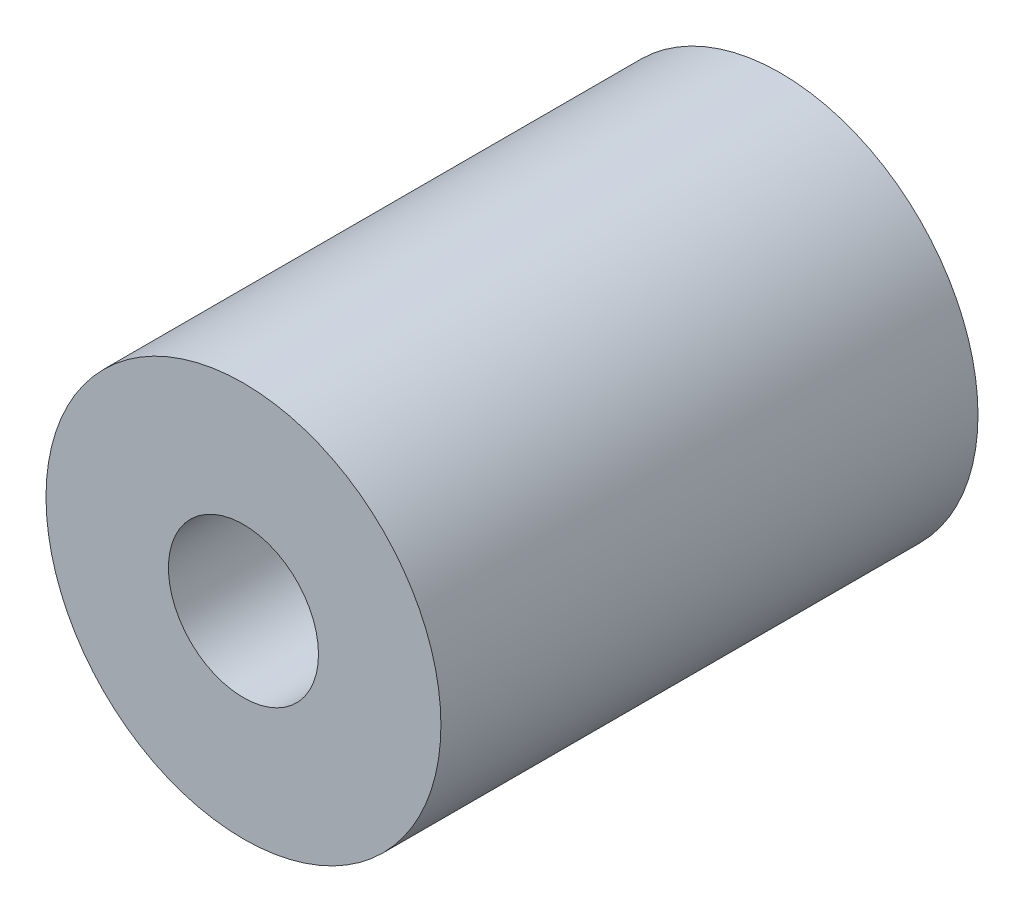
from build123d import *


with BuildPart() as part:
    # Sketch1 → REV_Bellows_Coupling_D50x68_bores_12_19 (revolve)
    with BuildSketch(Plane(origin=(0, 0, 0), x_dir=(1, 0, 0), z_dir=(0, 1, 0))):
        Polygon((6, -55), (25, -55), (25, -123), (9.5, -123), (9.5, -85), (20, -85), (20, -75), (6, -75), align=None)
    revolve(axis=Axis((0, 0, 150), (0, 0, -1)))


solid = part.part
